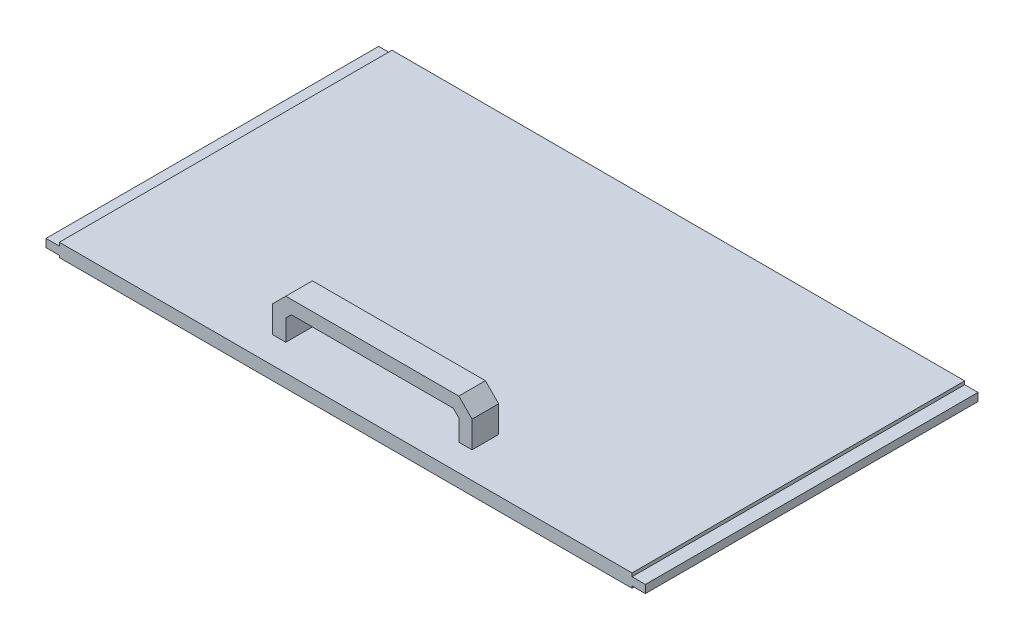
from build123d import *

# Parameters (mm, degrees)
SKETCH_1_W          = 430.43
SKETCH_1_H          = 250
EXTRUDE_1_DEPTH     = 10
SKETCH_2_W          = 250
SKETCH_2_H          = 6
EXTRUDE_2_DEPTH     = 10
SKETCH_3_W          = 150
SKETCH_3_H          = 20
EXTRUDE_3_DEPTH     = 30
CHAMFER_2_SIZE      = 10
CHAMFER_3_SIZE      = 10
CUT_EXTRUDE_2_DEPTH = 30


with BuildPart() as part:
    # 草图1 → 凸台-拉伸1 (new body)
    with BuildSketch(Plane(origin=(0, 0, 0), x_dir=(1, 0, 0), z_dir=(0, 1, 0))):
        with Locations((22.318592593, -1.184950617)):
            Rectangle(SKETCH_1_W, SKETCH_1_H)
    extrude(amount=EXTRUDE_1_DEPTH)

    # 草图2 → 凸台-拉伸2 (add)
    with BuildSketch(Plane(origin=(237.533592593, 0, 0), x_dir=(0, 0, -1), z_dir=(1, 0, 0))):
        with Locations((-1.184950617, 4.5)):
            Rectangle(SKETCH_2_W, SKETCH_2_H)
    extrude_2 = extrude(amount=EXTRUDE_2_DEPTH)

    # 镜向1: 凸台-拉伸2 across plane
    add(extrude_2.mirror(Plane(origin=(22.318592593, 0, 0), x_dir=(0, 0, 1), z_dir=(1, 0, 0))))

    # 草图3 → 凸台-拉伸3 (add)
    with BuildSketch(Plane(origin=(0, 10, 0), x_dir=(1, 0, 0), z_dir=(0, 1, 0))):
        with Locations((22.318592593, -96.184950617)):
            Rectangle(SKETCH_3_W, SKETCH_3_H)
    extrude(amount=EXTRUDE_3_DEPTH)

    # 倒角2
    chamfer_2_edges = [part.edges().sort_by_distance(p)[0] for p in [
        (97.318592593, 40, 96.184950617),
    ]]
    chamfer(chamfer_2_edges, length=CHAMFER_2_SIZE)

    # 倒角3
    chamfer_3_edges = [part.edges().sort_by_distance(p)[0] for p in [
        (-52.681407407, 40, 96.184950617),
    ]]
    chamfer(chamfer_3_edges, length=CHAMFER_3_SIZE)

    # 草图5 → 切除-拉伸2 (cut)
    with BuildSketch(Plane(origin=(0, 0, 86.184950617), x_dir=(-1, 0, 0), z_dir=(0, 0, -1))):
        Polygon((-87.318592593, 20), (-87.318592593, 10), (42.681407407, 10), (42.681407407, 20), (42.681407407, 25.857864376), (38.539271784, 30), (-83.176456969, 30), (-87.318592593, 25.857864376), align=None)
    extrude(amount=-CUT_EXTRUDE_2_DEPTH, mode=Mode.SUBTRACT)


solid = part.part
